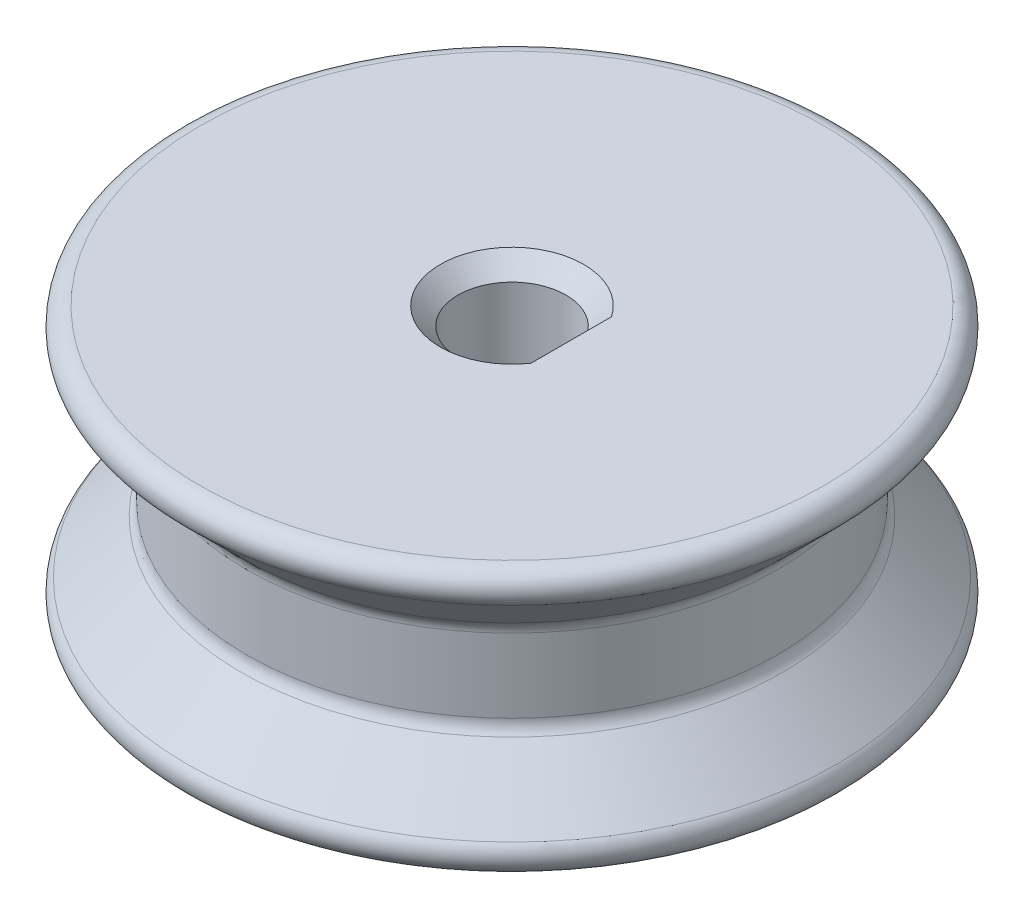
from build123d import *

# Parameters (mm, degrees)
BOSS_EXTRUDE1_DEPTH = 10
CHAMFER1_SIZE       = 1


with BuildPart() as part:
    # Sketch1 → Revolve1 (revolve)
    with BuildSketch(Plane.XY):
        with BuildLine():
            Line((0, 0), (0, 15))
            Line((0, 15), (14.56869778, 15))
            ThreePointArc((14.56869778, 15), (15.493526394, 14.380384062), (15.27227791, 13.289384069))
            Line((15.27227791, 13.289384069), (12.24641987, 10.29348502))
            ThreePointArc((12.24641987, 10.29348502), (12.027075266, 9.967849524), (11.95, 9.582869089))
            Line((11.95, 9.582869089), (11.95, 5.417130911))
            ThreePointArc((11.95, 5.417130911), (12.027075266, 5.032150476), (12.24641987, 4.70651498))
            Line((12.24641987, 4.70651498), (15.27227791, 1.710615931))
            ThreePointArc((15.27227791, 1.710615931), (15.493526394, 0.619615938), (14.56869778, 0))
            Line((14.56869778, 0), (0, 0))
        make_face()
    revolve(axis=Axis((-3.05, 12, 0), (0, -1, 0)))

    # Sketch2 → Boss-Extrude1 (add)
    with BuildSketch(Plane(origin=(0, 15, 0), x_dir=(1, 0, 0), z_dir=(0, 1, 0))):
        with BuildLine():
            ThreePointArc((0, 0), (-0.18033103, 1.033198916), (-0.7, 1.94422221))
            Line((-0.7, 1.94422221), (-0.7, -1.94422221))
            ThreePointArc((-0.7, -1.94422221), (-0.18033103, -1.033198916), (0, 0))
        make_face()
    extrude(amount=-BOSS_EXTRUDE1_DEPTH)

    # Chamfer1
    chamfer1_edges = [part.edges().sort_by_distance(p)[0] for p in [
        (-0.7, 15, 0),
        (-6.1, 15, 0),
    ]]
    chamfer(chamfer1_edges, length=CHAMFER1_SIZE)


solid = part.part
